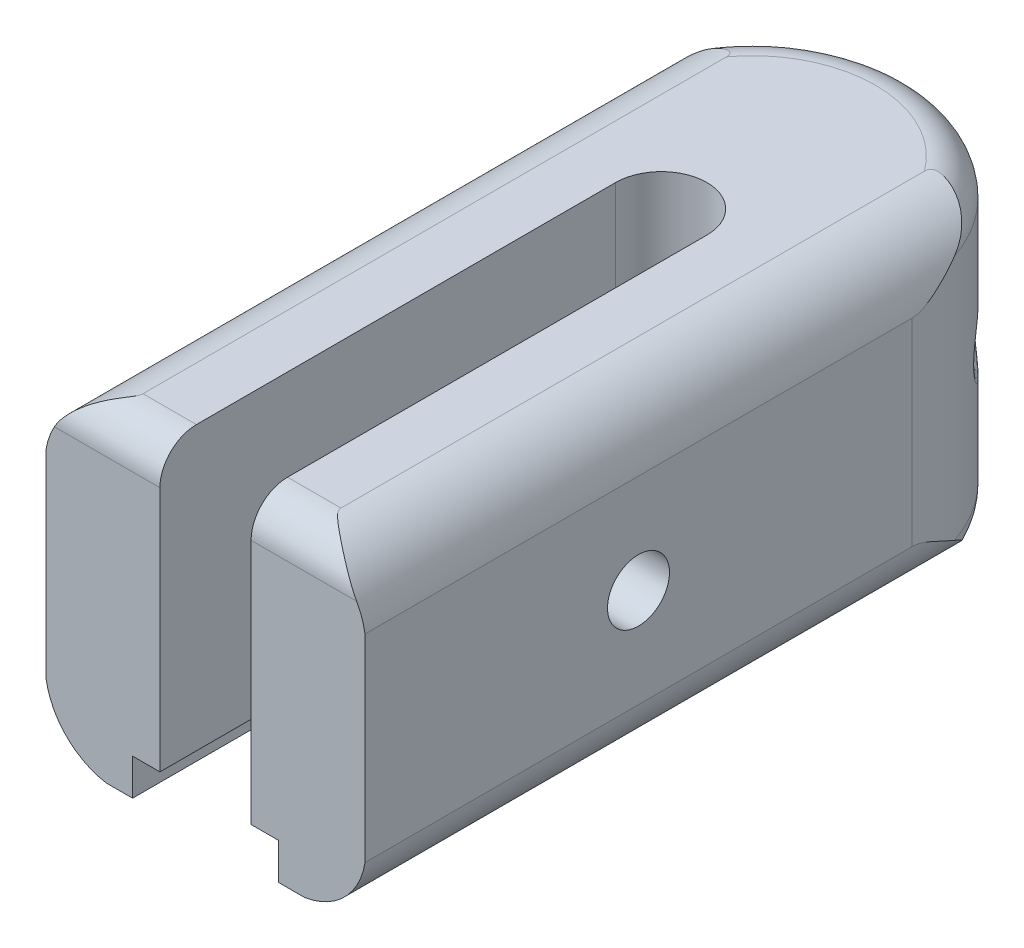
from build123d import *

# Parameters (mm, degrees)
SKETCH1_W                       = 22.225
SKETCH1_H                       = 22.225
BOSS_EXTRUDE1_DEPTH             = 38.1
BOSS_EXTRUDE3_REACH             = 43.214
BOSS_EXTRUDE3_DIRECTION_2_REACH = 43.214
SKETCH4_R                       = 2.159
CUT_EXTRUDE1_DEPTH              = 46.486792383
SKETCH8_R                       = 1.5875
CUT_EXTRUDE3_DEPTH              = 8.89
SKETCH7_R                       = 1.5875
CUT_EXTRUDE4_DEPTH              = 8.89
CUT_EXTRUDE6_DEPTH              = 46.486792456
FILLET1_R                       = 0.508
BOSS_EXTRUDE15_DEPTH            = 2.54
SKETCH18_W                      = 10.16
SKETCH18_H                      = 6.120141002
CUT_EXTRUDE7_DEPTH              = 36.83
CUT_EXTRUDE9_DEPTH              = 52.660869941
CUT_EXTRUDE9_DEPTH_BACK         = 52.660869941
SKETCH19_OUTSIDE_W              = 35.904
SKETCH19_OUTSIDE_H              = 35.904
FILLET15_R                      = 2.54


with BuildPart() as part:
    # Sketch1 → Boss-Extrude1 (new body)
    with BuildSketch(Plane.XY):
        Rectangle(SKETCH1_W, SKETCH1_H)
    extrude(amount=BOSS_EXTRUDE1_DEPTH)

    # Boss-Extrude3: up to this face of the body (flat: up to its plane)
    boss_extrude3_end = Plane(part.part.faces().sort_by_distance((0, 11.1125, 19.05))[0])
    # Sketch3 → Boss-Extrude3 (add, up to the picked face)
    with BuildSketch(Plane(origin=(0, 0, 0), x_dir=(1, 0, 0), z_dir=(0, 1, 0)), mode=Mode.PRIVATE) as boss_extrude3_sk1:
        with BuildLine():
            Line((-11.1125, 0), (11.1125, 0))
            ThreePointArc((11.1125, 0), (0, 11.1125), (-11.1125, 0))
        make_face()
    boss_extrude3_tool1 = split(extrude(boss_extrude3_sk1.sketch, amount=BOSS_EXTRUDE3_REACH, mode=Mode.PRIVATE), bisect_by=boss_extrude3_end, keep=Keep.BOTH, mode=Mode.PRIVATE)
    add(boss_extrude3_tool1.solids().sort_by(Axis((0, 0, -4.716291), (0, 1, 0)))[0])

    # Boss-Extrude3 direction 2: up to this face of the body (flat: up to its plane)
    boss_extrude3_direction_2_end = Plane(part.part.faces().sort_by_distance((0, -11.1125, 19.05))[0])
    # Sketch3 → Boss-Extrude3 direction 2 (add, up to the picked face)
    with BuildSketch(Plane(origin=(0, 0, 0), x_dir=(1, 0, 0), z_dir=(0, 1, 0)), mode=Mode.PRIVATE) as boss_extrude3_direction_2_sk1:
        with BuildLine():
            Line((-11.1125, 0), (11.1125, 0))
            ThreePointArc((11.1125, 0), (0, 11.1125), (-11.1125, 0))
        make_face()
    boss_extrude3_direction_2_tool1 = split(extrude(boss_extrude3_direction_2_sk1.sketch, amount=-BOSS_EXTRUDE3_DIRECTION_2_REACH, mode=Mode.PRIVATE), bisect_by=boss_extrude3_direction_2_end, keep=Keep.BOTH, mode=Mode.PRIVATE)
    add(boss_extrude3_direction_2_tool1.solids().sort_by(Axis((0, 0, -4.716291), (0, -1, 0)))[0])

    # Sketch4 → Cut-Extrude1 (cut, through all)
    with BuildSketch(Plane(origin=(11.1125, 0, 0), x_dir=(0, 0, -1), z_dir=(1, 0, 0))):
        with Locations((-19.05, 0)):
            Circle(SKETCH4_R)
    extrude(amount=-CUT_EXTRUDE1_DEPTH, mode=Mode.SUBTRACT)

    # Sketch8 → Cut-Extrude3 (cut)
    with BuildSketch(Plane(origin=(7.857724106, 0, -7.857724106), x_dir=(-0.7071067811865515, 0, -0.7071067811865436), z_dir=(0.7071067811865436, 0, -0.7071067811865515))):
        Circle(SKETCH8_R)
    extrude(amount=-CUT_EXTRUDE3_DEPTH, mode=Mode.SUBTRACT)

    # Sketch7 → Cut-Extrude4 (cut)
    with BuildSketch(Plane(origin=(-7.857724106, 0, -7.857724106), x_dir=(0.7071067811865512, 0, -0.7071067811865439), z_dir=(0.7071067811865439, 0, 0.7071067811865512))):
        with Locations(Location((0, 0, 0), (0, 0, 180))):
            Circle(SKETCH7_R)
    extrude(amount=CUT_EXTRUDE4_DEPTH, mode=Mode.SUBTRACT)

    # Sketch10 → Cut-Extrude6 (cut, through all)
    with BuildSketch(Plane(origin=(0, -11.1125, 0), x_dir=(-1, 0, 0), z_dir=(0, -1, 0))):
        with BuildLine():
            Line((3.175, -6.35), (3.175, -44.45))
            ThreePointArc((3.175, -44.45), (0, -47.625), (-3.175, -44.45))
            Line((-3.175, -44.45), (-3.175, -6.35))
            ThreePointArc((-3.175, -6.35), (0, -3.175), (3.175, -6.35))
        make_face()
    extrude(amount=-CUT_EXTRUDE6_DEPTH, mode=Mode.SUBTRACT)

    # Fillet1
    fillet1_edges = [part.edges().sort_by_distance(p)[0] for p in [
        (8.89966195, 5e-09, -6.654597918),
        (-6.654597918, -5e-09, -8.89966195),
    ]]
    fillet(fillet1_edges, radius=FILLET1_R)

    # Sketch14 → Boss-Extrude15 (add, symmetric)
    with BuildSketch(Plane(origin=(0, 0, 0), x_dir=(1, 0, 0), z_dir=(0, 1, 0))):
        Polygon((0.332639056, 2.225283), (-2.103732557, -0.211088613), (0.082871249, -2.397692418), (2.519242862, 0.038679195), align=None)
    extrude(amount=BOSS_EXTRUDE15_DEPTH, both=True)

    # Sketch18 → Cut-Extrude7 (cut)
    with BuildSketch(Plane.XY.offset(38.1)):
        with Locations((0, -11.632570501)):
            Rectangle(SKETCH18_W, SKETCH18_H)
    extrude(amount=-CUT_EXTRUDE7_DEPTH, mode=Mode.SUBTRACT)

    # Sketch19 outside → Cut-Extrude9 (cut, two sides: drawn at the far end of the back side and taken through both)
    with BuildSketch(Plane.XY.offset(38.1).offset(-CUT_EXTRUDE9_DEPTH_BACK)):
        Rectangle(SKETCH19_OUTSIDE_W, SKETCH19_OUTSIDE_H)
        with BuildLine():
            Line((-6.096, 11.176), (6.096, 11.176))
            ThreePointArc((6.096, 11.176), (9.688102448, 9.688102448), (11.176, 6.096))
            Line((11.176, 6.096), (11.176, -6.096))
            ThreePointArc((11.176, -6.096), (9.688102448, -9.688102448), (6.096, -11.176))
            Line((6.096, -11.176), (-6.096, -11.176))
            ThreePointArc((-6.096, -11.176), (-9.688102448, -9.688102448), (-11.176, -6.096))
            Line((-11.176, -6.096), (-11.176, 6.096))
            ThreePointArc((-11.176, 6.096), (-9.688102448, 9.688102448), (-6.096, 11.176))
        make_face(mode=Mode.SUBTRACT)
    extrude(amount=CUT_EXTRUDE9_DEPTH + CUT_EXTRUDE9_DEPTH_BACK, mode=Mode.SUBTRACT)

    # Fillet15
    fillet15_edges = [part.edges().sort_by_distance(p)[0] for p in [
        (0, -11.1125, -11.1125),
        (0, 11.1125, -11.1125),
        (5.035852267, 11.1125, 38.1),
        (-5.035852267, 11.1125, 38.1),
    ]]
    fillet(fillet15_edges, radius=FILLET15_R)


solid = part.part
